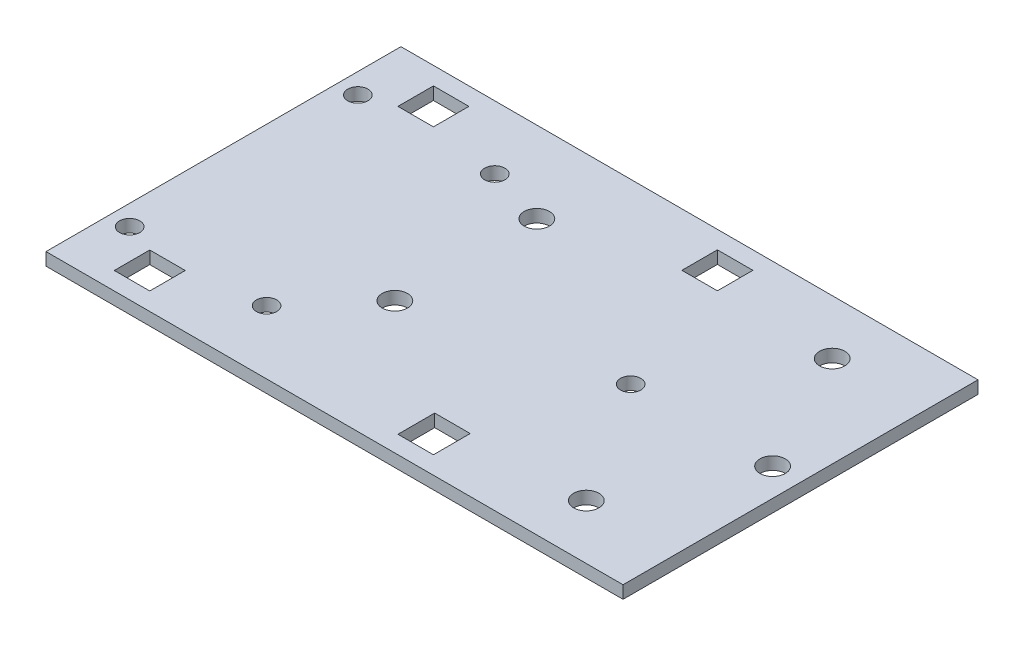
from build123d import *

# Parameters (mm, degrees)
SKETCH1_W           = 7
SKETCH1_H           = 7
SKETCH1_R           = 2
SKETCH1_R_2         = 2.5
SKETCH1_H_2         = 7.25
SKETCH1_R_3         = 2.502389359
BOSS_EXTRUDE1_DEPTH = 2.5


with BuildPart() as part:
    # Sketch1 → Boss-Extrude1 (new body)
    with BuildSketch(Plane(origin=(0, 0, 0), x_dir=(1, 0, 0), z_dir=(0, 1, 0))):
        Polygon((-45.382608696, 29.153623188), (-80.382608696, 29.153623188), (-80.382608696, 25.653623188), (-80.382608696, 16.653623188), (-80.382608696, 4.153623188), (-80.382608696, -15.846376812), (-80.382608696, -28.346376812), (-80.382608696, -37.346376812), (-80.382608696, -40.846376812), (33.417391304, -40.846376812), (33.417391304, -5.846376812), (33.417391304, 29.153623188), (15.417391304, 29.153623188), (-37.582608696, 29.153623188), align=None)
        with Locations((-66.92185538, -33.846376812)):
            Rectangle(SKETCH1_W, SKETCH1_H, mode=Mode.SUBTRACT)
        with Locations(Location((-76.382608696, -28.346376812, 0), (0, 0, 270))):
            Circle(SKETCH1_R, mode=Mode.SUBTRACT)
        with Locations(Location((-49.382608696, -28.346376812, 0), (0, 0, 270))):
            Circle(SKETCH1_R, mode=Mode.SUBTRACT)
        with Locations(Location((-37.582608696, -14.846376812, 0), (0, 0, 270))):
            Circle(SKETCH1_R_2, mode=Mode.SUBTRACT)
        with Locations((-10.97764978, -33.721376812)):
            Rectangle(SKETCH1_W, SKETCH1_H_2, mode=Mode.SUBTRACT)
        with Locations(Location((15.417391304, -30.096376812, 0), (0, 0, 270))):
            Circle(SKETCH1_R_2, mode=Mode.SUBTRACT)
        with Locations(Location((-0.082608696, -5.846376812, 0), (0, 0, 270))):
            Circle(SKETCH1_R, mode=Mode.SUBTRACT)
        with Locations(Location((-76.382608696, 16.653623188, 0), (0, 0, 270))):
            Circle(SKETCH1_R, mode=Mode.SUBTRACT)
        Polygon((-70.47764978, 18.653623188), (-70.47764978, 25.653623188), (-70.42185538, 25.653623188), (-63.47764978, 25.653623188), (-63.47764978, 18.653623188), (-70.42185538, 18.653623188), align=None, mode=Mode.SUBTRACT)
        with Locations(Location((-49.382608696, 16.653623188, 0), (0, 0, 270))):
            Circle(SKETCH1_R, mode=Mode.SUBTRACT)
        with Locations(Location((-37.582608696, 13.153623188, 0), (0, 0, 270))):
            Circle(SKETCH1_R_2, mode=Mode.SUBTRACT)
        with Locations(Location((27.917391304, -5.846376812, 0), (0, 0, 270))):
            Circle(SKETCH1_R_3, mode=Mode.SUBTRACT)
        with Locations((-10.97764978, 22.153623188)):
            Rectangle(SKETCH1_W, SKETCH1_H, mode=Mode.SUBTRACT)
        with Locations(Location((15.417391304, 18.403623188, 0), (0, 0, 270))):
            Circle(SKETCH1_R_2, mode=Mode.SUBTRACT)
    extrude(amount=BOSS_EXTRUDE1_DEPTH)


solid = part.part
